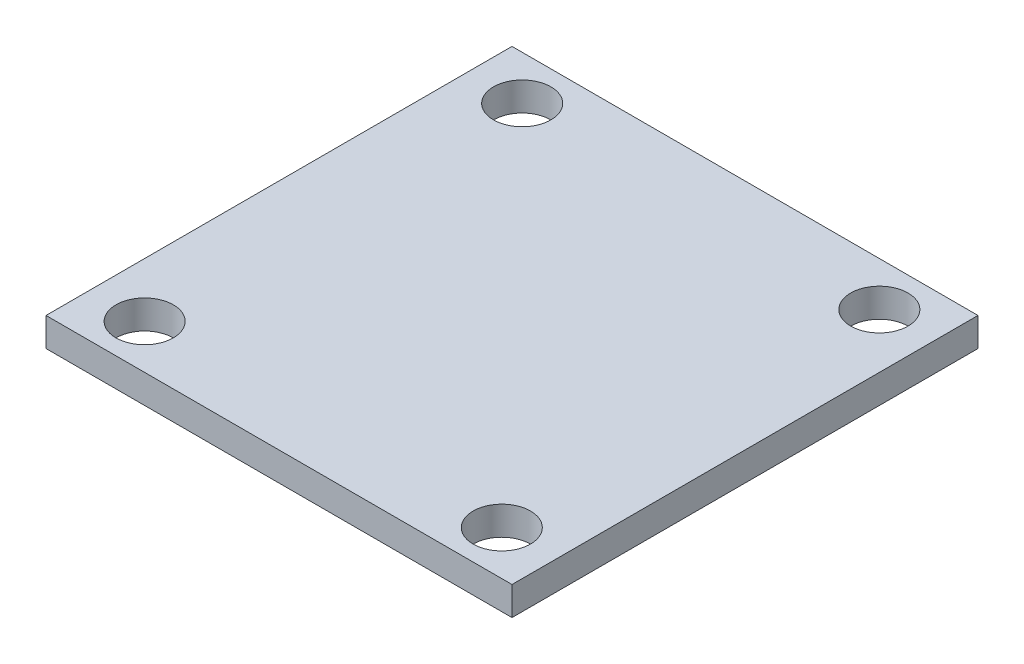
from build123d import *

# Parameters (mm, degrees)
SKETCH1_W           = 26
SKETCH1_H           = 26
BOSS_EXTRUDE1_DEPTH = 1.6
SKETCH3_R           = 1.6
CUT_EXTRUDE1_DEPTH  = 1.6


with BuildPart() as part:
    # Sketch1 → Boss-Extrude1 (new body)
    with BuildSketch(Plane(origin=(0, 0, 0), x_dir=(1, 0, 0), z_dir=(0, 1, 0))):
        Rectangle(SKETCH1_W, SKETCH1_H)
    extrude(amount=BOSS_EXTRUDE1_DEPTH)

    # Sketch3 → Cut-Extrude1 (cut)
    with BuildSketch(Plane(origin=(0, 1.6, 0), x_dir=(1, 0, 0), z_dir=(0, 1, 0))):
        with Locations(Location((-9.963772605, 10.532824273, 0), (0, 0, 270))):
            Circle(SKETCH3_R)
        with Locations(Location((-9.963772605, -10.532824273, 0), (0, 0, 270))):
            Circle(SKETCH3_R)
        with Locations(Location((9.963772605, 10.532824273, 0), (0, 0, 270))):
            Circle(SKETCH3_R)
        with Locations(Location((9.963772605, -10.532824273, 0), (0, 0, 270))):
            Circle(SKETCH3_R)
    extrude(amount=-CUT_EXTRUDE1_DEPTH, mode=Mode.SUBTRACT)


solid = part.part
